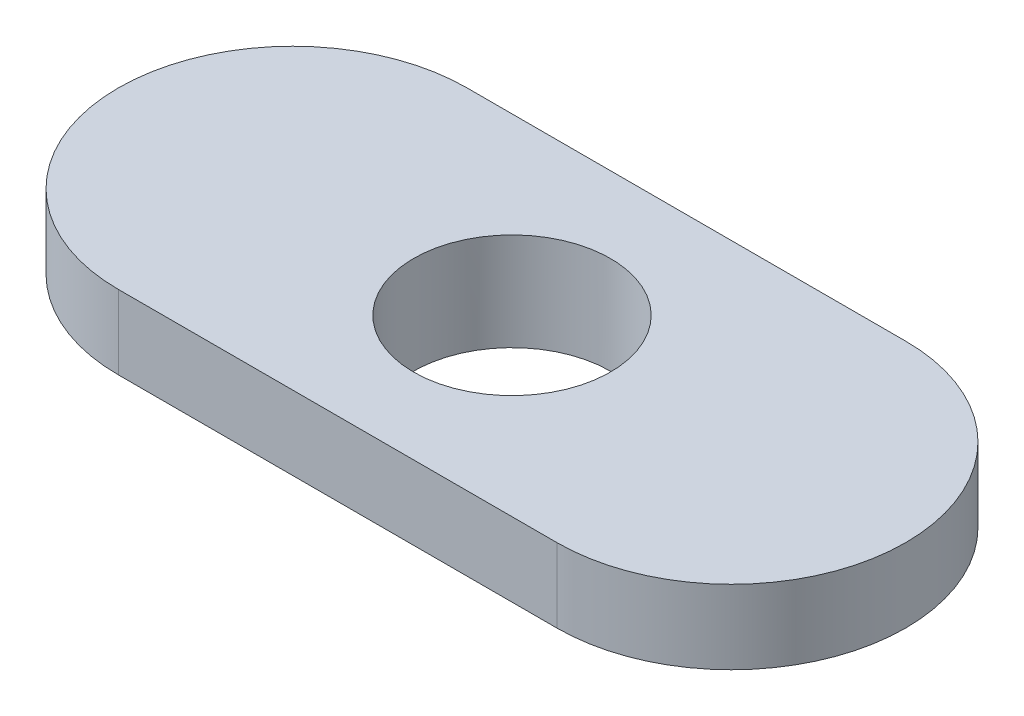
from build123d import *

# Parameters (mm, degrees)
BOSS_EXTRUDE2_START = -6.35
SKETCH8_R           = 3.175
BOSS_EXTRUDE2_DEPTH = 2.3876
SKETCH9_R           = 3.5687
SKETCH9_R_2         = 3.175
BOSS_EXTRUDE3_DEPTH = 0.762


with BuildPart() as part:
    # Sketch8 → Boss-Extrude2 (new body)
    with BuildSketch(Plane(origin=(0, 0, 0), x_dir=(1, 0, 0), z_dir=(0, 1, 0)).offset(BOSS_EXTRUDE2_START)):
        with BuildLine():
            Line((-7.0739, 5.6261), (7.0739, 5.6261))
            ThreePointArc((7.0739, 5.6261), (12.7, 0), (7.0739, -5.6261))
            Line((7.0739, -5.6261), (-7.0739, -5.6261))
            ThreePointArc((-7.0739, -5.6261), (-12.7, 0), (-7.0739, 5.6261))
        make_face()
        with Locations(Location((0, 0, 0), (0, 0, 270))):
            Circle(SKETCH8_R, mode=Mode.SUBTRACT)
    extrude(amount=-BOSS_EXTRUDE2_DEPTH)

    # Sketch9 → Boss-Extrude3 (add)
    with BuildSketch(Plane.XZ.offset(8.7376)):
        with Locations(Location((0, 0, 0), (0, 0, 90))):
            Circle(SKETCH9_R)
        with Locations(Location((0, 0, 0), (0, 0, 90))):
            Circle(SKETCH9_R_2, mode=Mode.SUBTRACT)
    extrude(amount=BOSS_EXTRUDE3_DEPTH)


solid = part.part
